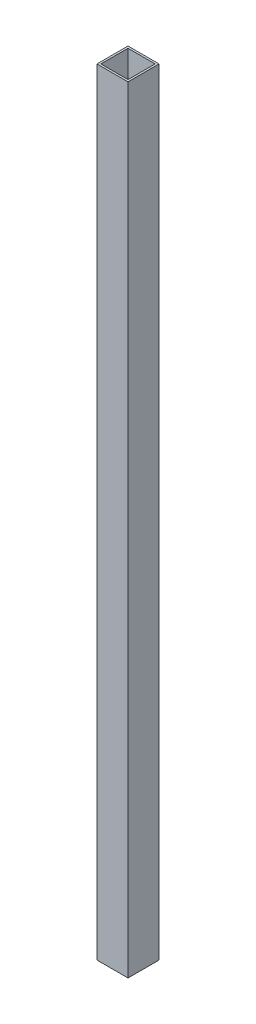
from build123d import *

# Parameters (mm, degrees)
SKETCH1_W           = 25.4
SKETCH1_H           = 25.4
SKETCH1_W_2         = 22.225
SKETCH1_H_2         = 22.225
BOSS_EXTRUDE1_DEPTH = 635


with BuildPart() as part:
    # Sketch1 → Boss-Extrude1 (new body)
    with BuildSketch(Plane(origin=(0, 0, 0), x_dir=(1, 0, 0), z_dir=(0, 1, 0))):
        Rectangle(SKETCH1_W, SKETCH1_H)
        Rectangle(SKETCH1_W_2, SKETCH1_H_2, mode=Mode.SUBTRACT)
    extrude(amount=BOSS_EXTRUDE1_DEPTH)


solid = part.part
